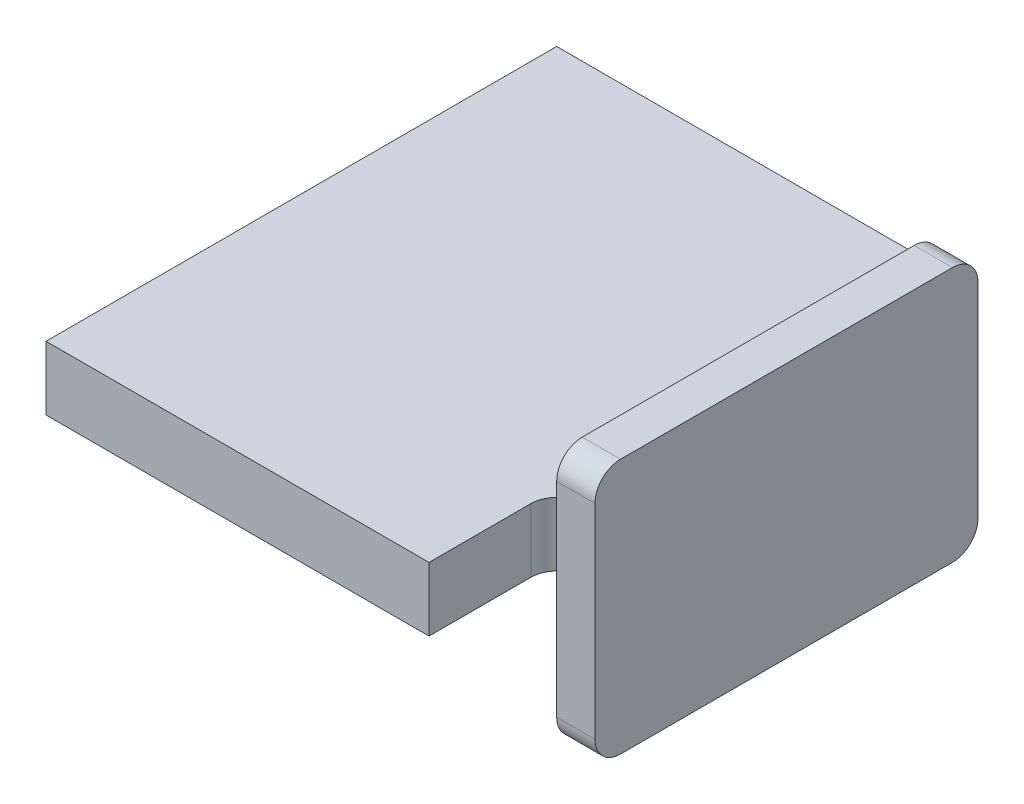
from build123d import *

# Parameters (mm, degrees)
SKETCH_1_W      = 20
SKETCH_1_H      = 5
EXTRUDE_1_DEPTH = 35
SKETCH_2_W      = 30
SKETCH_2_H      = 20
EXTRUDE_2_DEPTH = 3
FILLET_1_R      = 2
FILLET_2_R      = 2
FILLET_3_R      = 2
FILLET_4_R      = 2
SKETCH_4_W      = 30
SKETCH_4_H      = 40
EXTRUDE_3_DEPTH = 2.5
FILLET_5_R      = 2
FILLET_6_R      = 2


with BuildPart() as part:
    # 草图1 → 凸台-拉伸1 (new body)
    with BuildSketch(Plane(origin=(0, 0, 0), x_dir=(0, 0, -1), z_dir=(1, 0, 0))):
        Rectangle(SKETCH_1_W, SKETCH_1_H)
    extrude(amount=-EXTRUDE_1_DEPTH)

    # 草图2 → 凸台-拉伸2 (add)
    with BuildSketch(Plane(origin=(0, 0, 0), x_dir=(0, 0, -1), z_dir=(1, 0, 0))):
        Rectangle(SKETCH_2_W, SKETCH_2_H)
    extrude(amount=EXTRUDE_2_DEPTH)

    # 圆角1
    fillet_1_edges = [part.edges().sort_by_distance(p)[0] for p in [
        (1.5, 10, -15),
    ]]
    fillet(fillet_1_edges, radius=FILLET_1_R)

    # 圆角2
    fillet_2_edges = [part.edges().sort_by_distance(p)[0] for p in [
        (1.5, 10, 15),
    ]]
    fillet(fillet_2_edges, radius=FILLET_2_R)

    # 圆角3
    fillet_3_edges = [part.edges().sort_by_distance(p)[0] for p in [
        (1.5, -10, -15),
    ]]
    fillet(fillet_3_edges, radius=FILLET_3_R)

    # 圆角4
    fillet_4_edges = [part.edges().sort_by_distance(p)[0] for p in [
        (1.5, -10, 15),
    ]]
    fillet(fillet_4_edges, radius=FILLET_4_R)

    # 草图4 → 凸台-拉伸3 (add, symmetric)
    with BuildSketch(Plane(origin=(0, 0, 0), x_dir=(1, 0, 0), z_dir=(0, 1, 0))):
        with Locations((-20, 0)):
            Rectangle(SKETCH_4_W, SKETCH_4_H)
    extrude(amount=EXTRUDE_3_DEPTH, both=True)

    # 圆角5
    fillet_5_edges = [part.edges().sort_by_distance(p)[0] for p in [
        (-5, 0, -10),
    ]]
    fillet(fillet_5_edges, radius=FILLET_5_R)

    # 圆角6
    fillet_6_edges = [part.edges().sort_by_distance(p)[0] for p in [
        (-5, 0, 10),
    ]]
    fillet(fillet_6_edges, radius=FILLET_6_R)


solid = part.part
